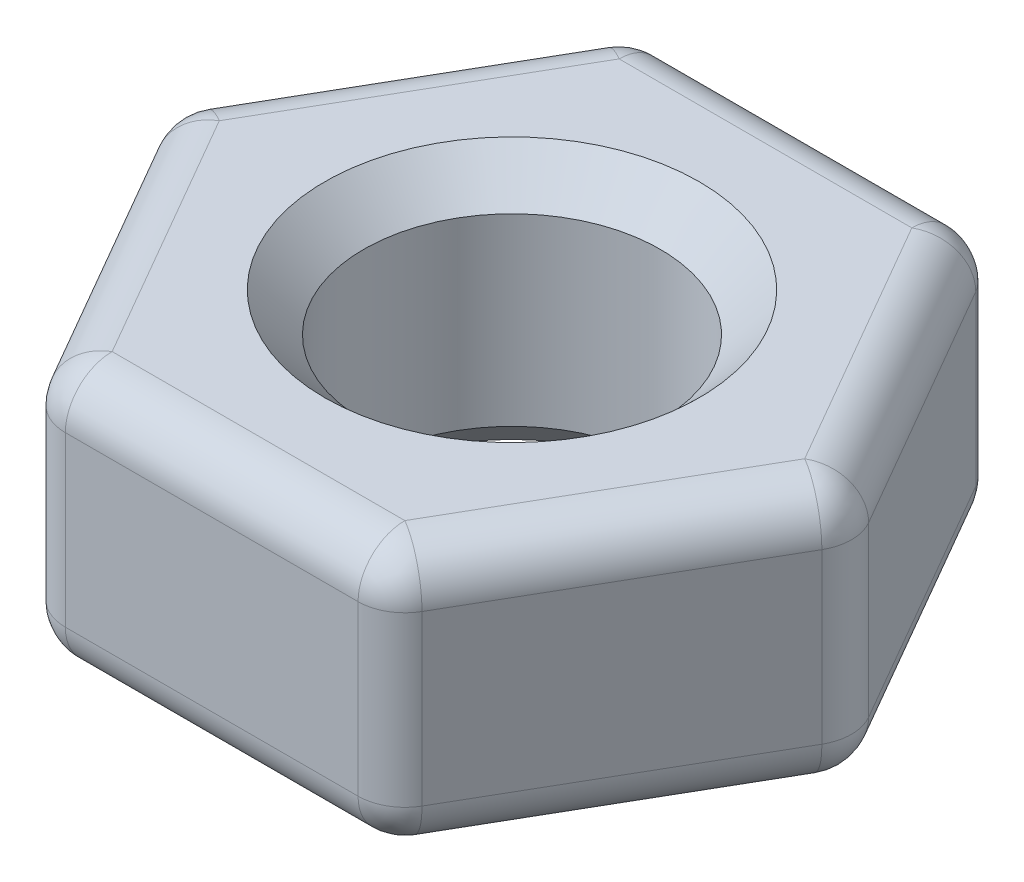
from build123d import *

# Parameters (mm, degrees)
SKETCH1_R           = 0.95
BOSS_EXTRUDE1_DEPTH = 1.68
CHAMFER2_SIZE       = 0.25
FILLET1_R           = 0.3


with BuildPart() as part:
    # Sketch1 → Boss-Extrude1 (new body)
    with BuildSketch(Plane(origin=(0, 0, 0), x_dir=(1, 0, 0), z_dir=(0, 1, 0))):
        Polygon((1.111399268, -1.925), (2.222798536, 0), (1.111399268, 1.925), (-1.111399268, 1.925), (-2.222798536, 0), (-1.111399268, -1.925), align=None)
        Circle(SKETCH1_R, mode=Mode.SUBTRACT)
    extrude(amount=BOSS_EXTRUDE1_DEPTH)

    # Chamfer2
    chamfer2_edges = [part.edges().sort_by_distance(p)[0] for p in [
        (-0.95, 1.68, 0),
        (-0.95, 0, 0),
    ]]
    chamfer(chamfer2_edges, length=CHAMFER2_SIZE)

    # Fillet1
    fillet1_edges = [part.edges().sort_by_distance(p)[0] for p in [
        (1.667098902, 1.68, -0.9625),
        (1.667098902, 0, -0.9625),
        (1.111399268, 0.84, -1.925),
        (0, 1.68, -1.925),
        (0, 0, -1.925),
        (-1.111399268, 0.84, -1.925),
        (-1.667098902, 1.68, -0.9625),
        (-1.667098902, 0, -0.9625),
        (-2.222798536, 0.84, 0),
        (-1.667098902, 1.68, 0.9625),
        (-1.667098902, 0, 0.9625),
        (-1.111399268, 0.84, 1.925),
        (0, 1.68, 1.925),
        (0, 0, 1.925),
        (1.111399268, 0.84, 1.925),
        (1.667098902, 1.68, 0.9625),
        (2.222798536, 0.84, 0),
        (1.667098902, 0, 0.9625),
    ]]
    fillet(fillet1_edges, radius=FILLET1_R)


solid = part.part
